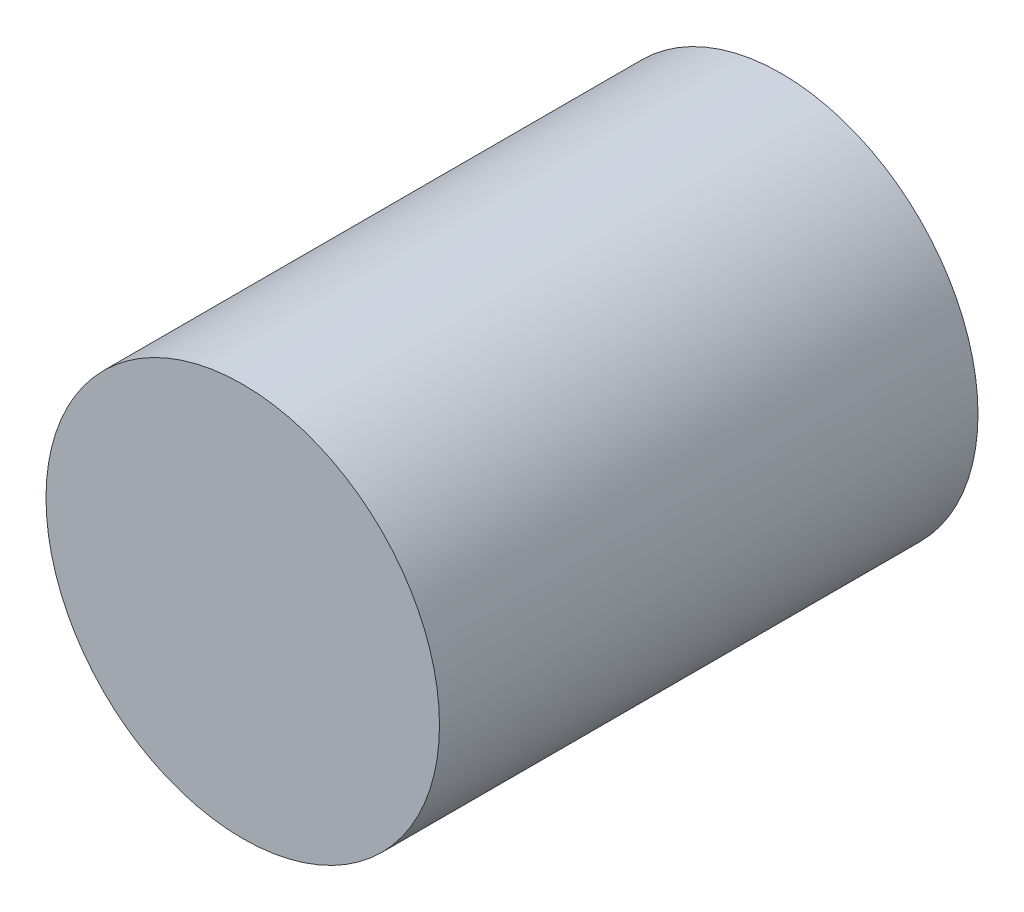
from build123d import *

# Parameters (mm, degrees)
SKETCH2_W = 19.05
SKETCH2_H = 6.9596


with BuildPart() as part:
    # Sketch2 → Revolve1 (revolve)
    with BuildSketch(Plane(origin=(0, 0, 0), x_dir=(0, 0, -1), z_dir=(1, 0, 0)), mode=Mode.PRIVATE) as revolve1_sk:
        with Locations((9.525, 3.4798)):
            Rectangle(SKETCH2_W, SKETCH2_H)
    revolve(revolve1_sk.sketch.rotate(Axis((0, 0, 0), (0, 0, -1)), 90), axis=Axis((0, 0, 0), (0, 0, -1)))


solid = part.part
